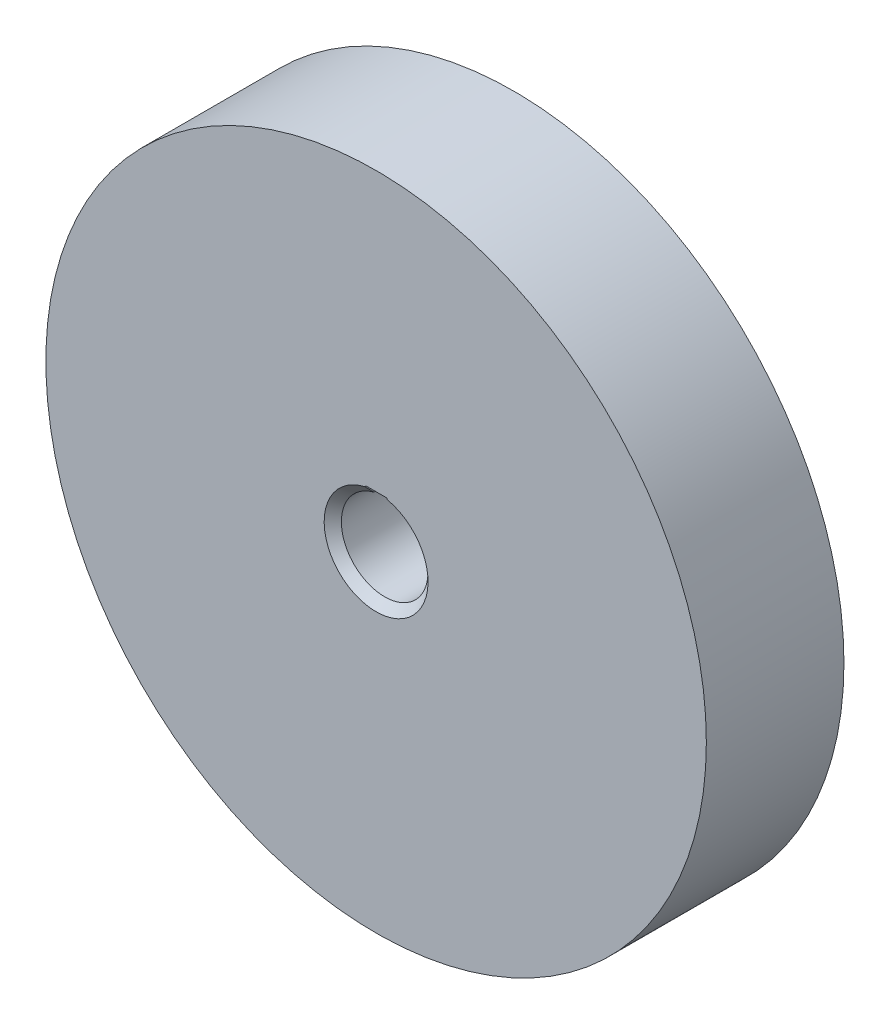
from build123d import *

# Parameters (mm, degrees)
SKETCH1_R          = 30.48
SKETCH1_R_2        = 4
EXTRUDE1_DEPTH     = 6.35
CHAMFER1_SIZE      = 0.79375
SKETCH3_W          = 2
SKETCH3_H          = 2
CUT_EXTRUDE1_DEPTH = 45.937187273


with BuildPart() as part:
    # Sketch1 → Extrude1 (new, symmetric)
    with BuildSketch(Plane.XY):
        Circle(SKETCH1_R)
        Circle(SKETCH1_R_2, mode=Mode.SUBTRACT)
    extrude(amount=EXTRUDE1_DEPTH, both=True)

    # Chamfer1
    chamfer1_edges = [part.edges().sort_by_distance(p)[0] for p in [
        (-4, 0, -6.35),
        (-4, 0, 6.35),
    ]]
    chamfer(chamfer1_edges, length=CHAMFER1_SIZE)

    # Sketch3 → Cut-Extrude1 (cut, through all)
    with BuildSketch(Plane.XY.offset(6.35)):
        with Locations((0, 3.8)):
            Rectangle(SKETCH3_W, SKETCH3_H)
    extrude(amount=-CUT_EXTRUDE1_DEPTH, mode=Mode.SUBTRACT)


solid = part.part
